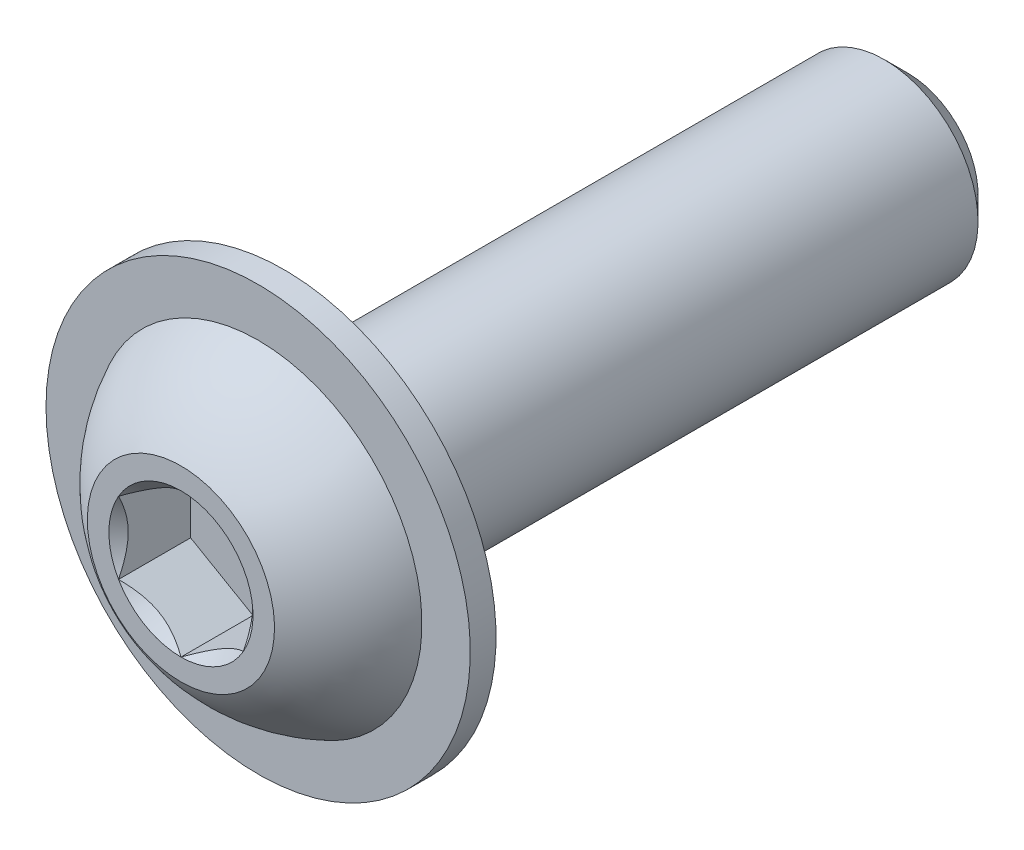
from build123d import *

# Parameters (mm, degrees)
SKETCH1_W           = 20
SKETCH1_H           = 3
CHAMFER1_SIZE       = 0.75
SKETCH11_R          = 6.8
BOSS_EXTRUDE3_DEPTH = 0.825
CUT_EXTRUDE2_DEPTH  = 2.31


with BuildPart() as part:
    # Sketch1 → Revolve1 (revolve)
    with BuildSketch(Plane(origin=(0, 0, 0), x_dir=(0, 0, -1), z_dir=(1, 0, 0))):
        with Locations((13.3, 1.5)):
            Rectangle(SKETCH1_W, SKETCH1_H)
    revolve(axis=Axis((0, 0, -23.3), (0, 0, 1)))

    # Chamfer1
    chamfer1_edges = [part.edges().sort_by_distance(p)[0] for p in [
        (0, -3, -23.3),
    ]]
    chamfer(chamfer1_edges, length=CHAMFER1_SIZE)

    # Sketch7 → Revolve2 (revolve)
    with BuildSketch(Plane(origin=(0, 0, 0), x_dir=(0, 0, -1), z_dir=(1, 0, 0)), mode=Mode.PRIVATE) as revolve2_sk:
        with BuildLine():
            Line((2.475, 5.25), (3.3, 5.25))
            Line((3.3, 5.25), (3.3, 0))
            Line((3.3, 0), (0, 0))
            Line((0, 0), (0, 3))
            ThreePointArc((0, 3), (1.072385059, 4.306626435), (2.475, 5.25))
        make_face()
    revolve(revolve2_sk.sketch.rotate(Axis((0, 0, 0), (0, 0, -1)), 180), axis=Axis((0, 0, 0), (0, 0, -1)))

    # Sketch11 → Boss-Extrude3 (add)
    with BuildSketch(Plane(origin=(0, 0, -3.3), x_dir=(-1, 0, 0), z_dir=(0, 0, -1))):
        Circle(SKETCH11_R)
    extrude(amount=-BOSS_EXTRUDE3_DEPTH)

    # Sketch5 → Cut-Extrude2 (cut)
    with BuildSketch(Plane.XY):
        Polygon((2, -1.154700538), (2, 1.154700538), (0, 2.309401077), (-2, 1.154700538), (-2, -1.154700538), (0, -2.309401077), align=None)
    extrude(amount=-CUT_EXTRUDE2_DEPTH, mode=Mode.SUBTRACT)

    # Cut-Extrude3 cone 1 section (through the dimple's axis) → Cut-Extrude3 (revolve, cut)
    with BuildSketch(Plane(origin=(0, 0, 0), x_dir=(0, -1, 0), z_dir=(1, 0, 0))):
        Polygon((0, 0), (2.309401077, 0), (0, 2.309401077), align=None)
    revolve(axis=Axis((0, 0, 0), (0, 0, -1)), mode=Mode.SUBTRACT)


solid = part.part
